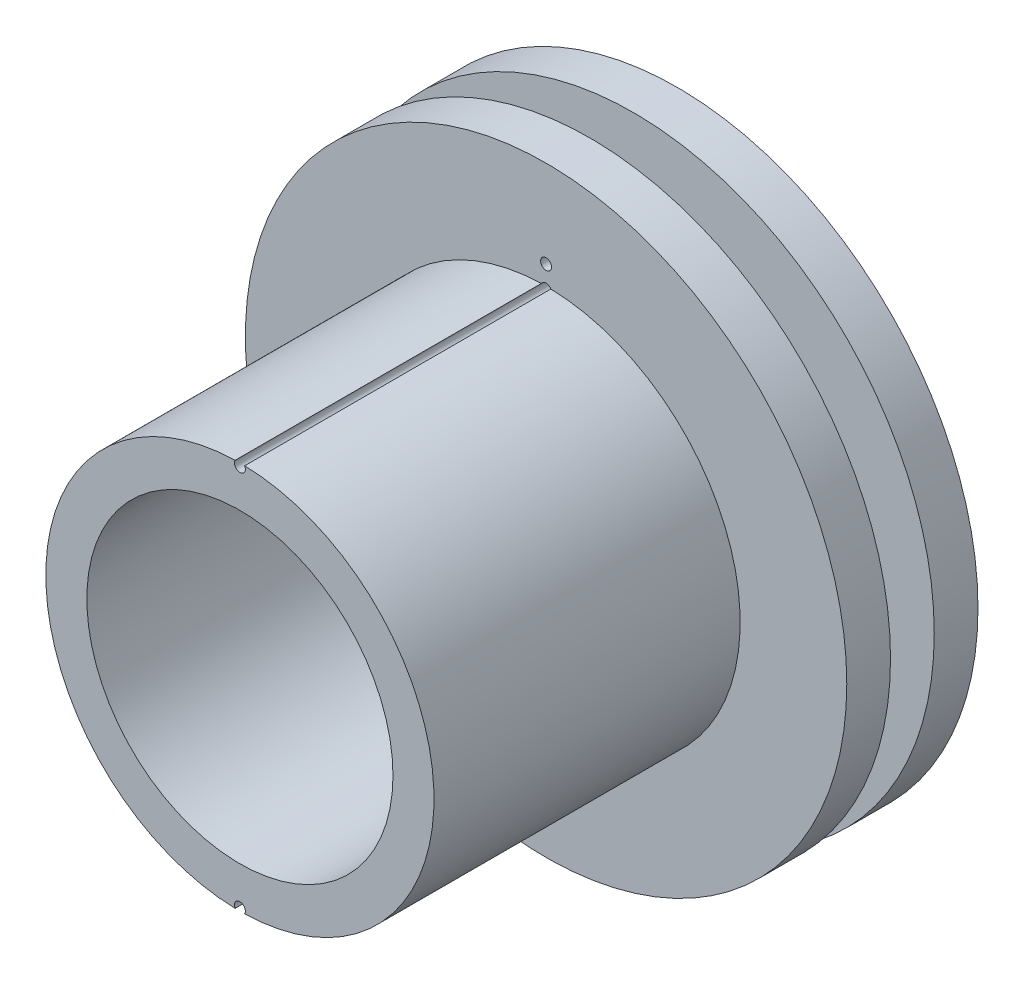
from build123d import *

# Parameters (mm, degrees)
SKETCH1_R           = 13.75
BOSS_EXTRUDE1_DEPTH = 2
SKETCH2_R           = 8.5
BOSS_EXTRUDE2_DEPTH = 6
BOSS_EXTRUDE3_START = 4
SKETCH3_R           = 13.75
BOSS_EXTRUDE3_DEPTH = 2
SKETCH5_R           = 7
CUT_EXTRUDE2_DEPTH  = 21.350061425
BOSS_EXTRUDE4_START = 6
SKETCH6_R           = 8.875
SKETCH6_R_2         = 7
BOSS_EXTRUDE4_DEPTH = 14
CUT_EXTRUDE3_START  = 4
SKETCH9_R           = 0.25
CUT_EXTRUDE3_DEPTH  = 24.894892006


with BuildPart() as part:
    # Sketch1 → Boss-Extrude1 (new body)
    with BuildSketch(Plane.XY):
        Circle(SKETCH1_R)
    extrude(amount=BOSS_EXTRUDE1_DEPTH)

    # Sketch2 → Boss-Extrude2 (add)
    with BuildSketch(Plane.XY):
        Circle(SKETCH2_R)
    extrude(amount=BOSS_EXTRUDE2_DEPTH)

    # Sketch3 → Boss-Extrude3 (add)
    with BuildSketch(Plane.XY.offset(BOSS_EXTRUDE3_START)):
        Circle(SKETCH3_R)
    extrude(amount=BOSS_EXTRUDE3_DEPTH)

    # Sketch5 → Cut-Extrude2 (cut, through all)
    with BuildSketch(Plane.XY):
        Circle(SKETCH5_R)
    extrude(amount=CUT_EXTRUDE2_DEPTH, mode=Mode.SUBTRACT)

    # Sketch6 → Boss-Extrude4 (add)
    with BuildSketch(Plane.XY.offset(BOSS_EXTRUDE4_START)):
        Circle(SKETCH6_R)
        Circle(SKETCH6_R_2, mode=Mode.SUBTRACT)
    extrude(amount=BOSS_EXTRUDE4_DEPTH)

    # Sketch9 → Cut-Extrude3 (cut, through all)
    with BuildSketch(Plane.XY.offset(CUT_EXTRUDE3_START)):
        with Locations((0, 9.75)):
            Circle(SKETCH9_R)
        with Locations((0, -9.75)):
            Circle(SKETCH9_R)
        with Locations(Location((0, 8.75, 0), (0, 0, 150.706355545))):
            Circle(SKETCH9_R)
        with Locations(Location((0, -8.75, 0), (0, 0, 209.293644455))):
            Circle(SKETCH9_R)
    extrude(amount=CUT_EXTRUDE3_DEPTH, mode=Mode.SUBTRACT)


solid = part.part
